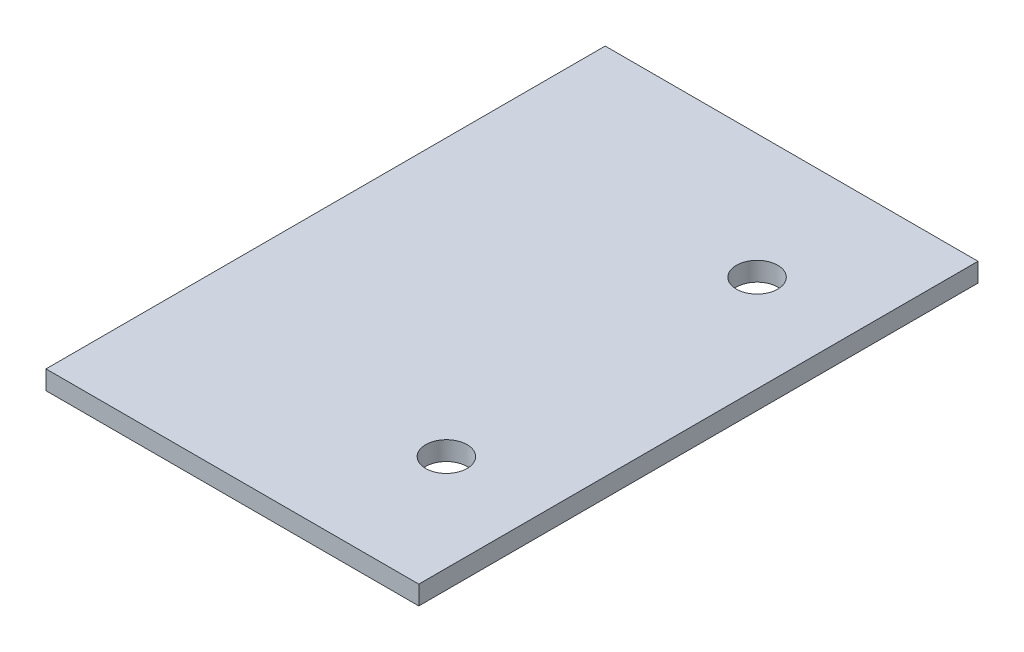
from build123d import *

# Parameters (mm, degrees)
SKETCH1_W           = 30
SKETCH1_H           = 45
BOSS_EXTRUDE1_DEPTH = 1.524
CUT_EXTRUDE1_REACH  = 29.085
SKETCH2_R           = 1.665


with BuildPart() as part:
    # Sketch1 → Boss-Extrude1 (new body)
    with BuildSketch(Plane(origin=(0, 0, 0), x_dir=(1, 0, 0), z_dir=(0, 1, 0))):
        Rectangle(SKETCH1_W, SKETCH1_H)
    extrude(amount=BOSS_EXTRUDE1_DEPTH)

    # Sketch2 → Cut-Extrude1 (cut, up to next)
    with BuildSketch(Plane(origin=(0, 1.524, 0), x_dir=(1, 0, 0), z_dir=(0, 1, 0)), mode=Mode.PRIVATE) as cut_extrude1_sk1:
        with Locations(Location((7.221380866, 12.5, 0), (0, 0, 270))):
            Circle(SKETCH2_R)
    cut_extrude1_tool1 = extrude(cut_extrude1_sk1.sketch, amount=-CUT_EXTRUDE1_REACH, mode=Mode.PRIVATE) & part.part
    # Sketch2 → Cut-Extrude1 (cut, up to next)
    with BuildSketch(Plane(origin=(0, 1.524, 0), x_dir=(1, 0, 0), z_dir=(0, 1, 0)), mode=Mode.PRIVATE) as cut_extrude1_sk2:
        with Locations(Location((7.221380866, -12.5, 0), (0, 0, 270))):
            Circle(SKETCH2_R)
    cut_extrude1_tool2 = extrude(cut_extrude1_sk2.sketch, amount=-CUT_EXTRUDE1_REACH, mode=Mode.PRIVATE) & part.part
    add(cut_extrude1_tool1.solids().sort_by_distance((7.221381, 1.524, -12.5))[0], mode=Mode.SUBTRACT)
    add(cut_extrude1_tool2.solids().sort_by_distance((7.221381, 1.524, 12.5))[0], mode=Mode.SUBTRACT)


solid = part.part
